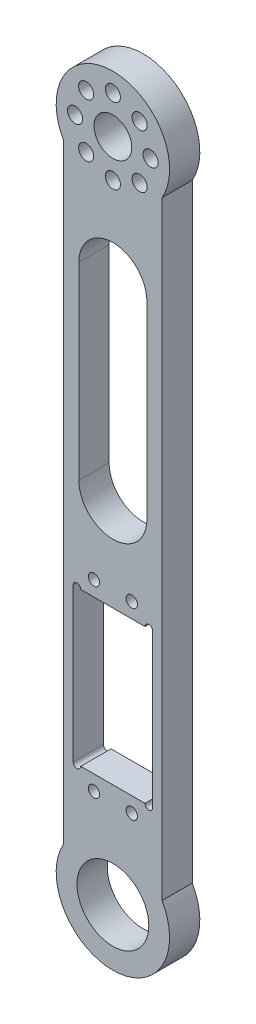
from build123d import *

# Parameters (mm, degrees)
EXTRUDE_1_DEPTH     = 8
SKETCH_2_R          = 5
SKETCH_2_R_2        = 2
SKETCH_2_R_3        = 9.5
CUT_EXTRUDE_1_DEPTH = 8
SKETCH_3_W          = 21
SKETCH_3_H          = 40.5
CUT_EXTRUDE_2_DEPTH = 10
SKETCH_4_R          = 1.5
CUT_EXTRUDE_3_DEPTH = 10
SKETCH_5_R          = 1
CUT_EXTRUDE_4_DEPTH = 10
SKETCH_6_W          = 18
SKETCH_6_H          = 50
CUT_EXTRUDE_5_DEPTH = 10


with BuildPart() as part:
    # 草图1 → 凸台-拉伸1 (new body)
    with BuildSketch(Plane.XY):
        with BuildLine():
            ThreePointArc((13, 80.516685226), (0, 73), (-13, 80.516685226))
            Line((-13, 80.516685226), (-13, -80.516685226))
            ThreePointArc((-13, -80.516685226), (0, -73), (13, -80.516685226))
            Line((13, -80.516685226), (13, 80.516685226))
        make_face()
        with BuildLine():
            Line((-13, 80.516685226), (-13, 88))
            Line((-13, 88), (13, 88))
            Line((13, 88), (13, 80.516685226))
            ThreePointArc((13, 80.516685226), (14.491376746, 84.127016654), (15, 88))
            ThreePointArc((15, 88), (-3.872983346, 102.491376746), (-13, 80.516685226))
        make_face()
        with BuildLine():
            Line((13, 88), (-13, 88))
            Line((-13, 88), (-13, 80.516685226))
            ThreePointArc((-13, 80.516685226), (0, 73), (13, 80.516685226))
            Line((13, 80.516685226), (13, 88))
        make_face()
        with BuildLine():
            ThreePointArc((13, -80.516685226), (0, -73), (-13, -80.516685226))
            Line((-13, -80.516685226), (-13, -88))
            Line((-13, -88), (13, -88))
            Line((13, -88), (13, -80.516685226))
        make_face()
        with BuildLine():
            Line((-13, -88), (-13, -80.516685226))
            ThreePointArc((-13, -80.516685226), (-3.872983346, -102.491376746), (15, -88))
            ThreePointArc((15, -88), (14.491376746, -84.127016654), (13, -80.516685226))
            Line((13, -80.516685226), (13, -88))
            Line((13, -88), (-13, -88))
        make_face()
    extrude(amount=EXTRUDE_1_DEPTH)

    # 草图2 → 切除-拉伸1 (cut)
    with BuildSketch(Plane.XY.offset(8)):
        with Locations((0, 88)):
            Circle(SKETCH_2_R)
        with Locations((0, 98)):
            Circle(SKETCH_2_R_2)
        with Locations((10, 88)):
            Circle(SKETCH_2_R_2)
        with Locations((0, 78)):
            Circle(SKETCH_2_R_2)
        with Locations((-10, 88)):
            Circle(SKETCH_2_R_2)
        with Locations((0, -88)):
            Circle(SKETCH_2_R_3)
        with Locations((7.071067812, 95.071067812)):
            Circle(SKETCH_2_R_2)
        with Locations((7.071067812, 80.928932188)):
            Circle(SKETCH_2_R_2)
        with Locations((-7.071067812, 80.928932188)):
            Circle(SKETCH_2_R_2)
        with Locations((-7.071067812, 95.071067812)):
            Circle(SKETCH_2_R_2)
    extrude(amount=-CUT_EXTRUDE_1_DEPTH, mode=Mode.SUBTRACT)

    # 草图3 → 切除-拉伸2 (cut)
    with BuildSketch(Plane.XY.offset(8)):
        with Locations((0, -40.25)):
            Rectangle(SKETCH_3_W, SKETCH_3_H)
    extrude(amount=-CUT_EXTRUDE_2_DEPTH, mode=Mode.SUBTRACT)

    # 草图4 → 切除-拉伸3 (cut)
    with BuildSketch(Plane.XY.offset(8)):
        with Locations((-5, -16)):
            Circle(SKETCH_4_R)
        with Locations((5, -16)):
            Circle(SKETCH_4_R)
        with Locations((-5, -64.5)):
            Circle(SKETCH_4_R)
        with Locations((5, -64.5)):
            Circle(SKETCH_4_R)
    extrude(amount=-CUT_EXTRUDE_3_DEPTH, mode=Mode.SUBTRACT)

    # 草图5 → 切除-拉伸4 (cut)
    with BuildSketch(Plane.XY.offset(8)):
        with Locations((-9.5, -20)):
            Circle(SKETCH_5_R)
        with Locations((9.5, -20)):
            Circle(SKETCH_5_R)
        with Locations((9.5, -60.5)):
            Circle(SKETCH_5_R)
        with Locations((-9.5, -60.5)):
            Circle(SKETCH_5_R)
    extrude(amount=-CUT_EXTRUDE_4_DEPTH, mode=Mode.SUBTRACT)

    # 草图6 → 切除-拉伸5 (cut)
    with BuildSketch(Plane.XY.offset(8)):
        with BuildLine():
            ThreePointArc((-9, 54.75), (0, 63.75), (9, 54.75))
            Line((9, 54.75), (-9, 54.75))
        make_face()
        with Locations((0, 29.75)):
            Rectangle(SKETCH_6_W, SKETCH_6_H)
        with BuildLine():
            Line((-9, 4.75), (9, 4.75))
            ThreePointArc((9, 4.75), (0, -4.25), (-9, 4.75))
        make_face()
    extrude(amount=-CUT_EXTRUDE_5_DEPTH, mode=Mode.SUBTRACT)


solid = part.part
